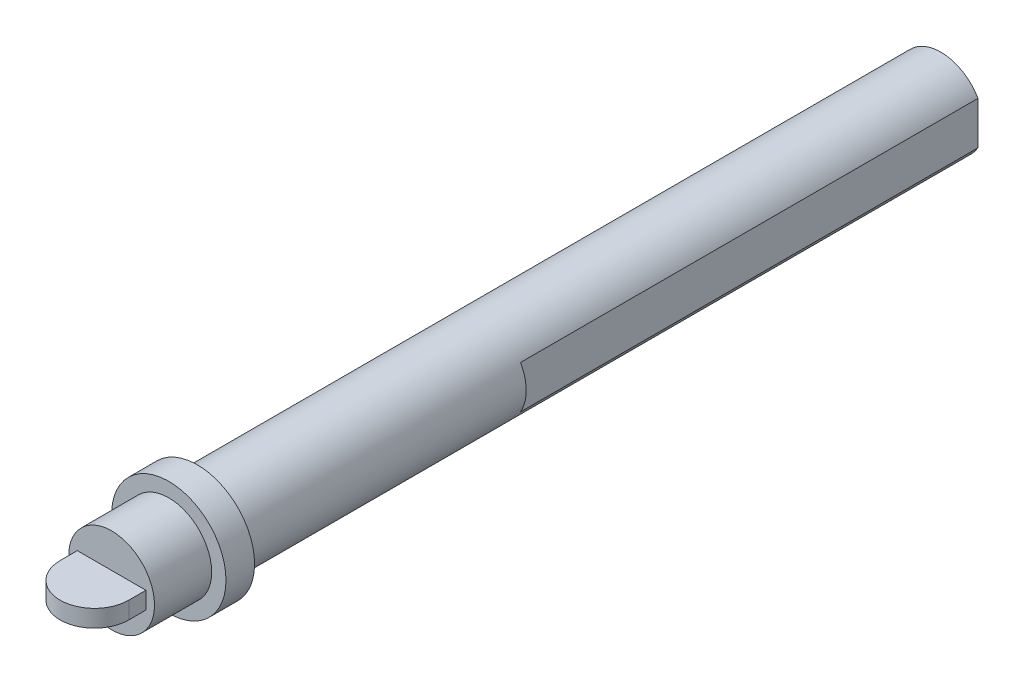
from build123d import *

# Parameters (mm, degrees)
SKETCH1_R           = 7.5
BOSS_EXTRUDE1_DEPTH = 130
SKETCH2_R           = 10
BOSS_EXTRUDE2_DEPTH = 5
BOSS_EXTRUDE3_START = 10
SKETCH3_R           = 7.5
BOSS_EXTRUDE3_DEPTH = 10
CUT_EXTRUDE1_START  = -80
CUT_EXTRUDE1_DEPTH  = 80
BOSS_EXTRUDE4_DEPTH = 1.5


with BuildPart() as part:
    # Sketch1 → Boss-Extrude1 (new body)
    with BuildSketch(Plane.XY):
        Circle(SKETCH1_R)
    extrude(amount=-BOSS_EXTRUDE1_DEPTH)

    # Sketch2 → Boss-Extrude2 (add)
    with BuildSketch(Plane.XY):
        Circle(SKETCH2_R)
    extrude(amount=BOSS_EXTRUDE2_DEPTH)

    # Sketch3 → Boss-Extrude3 (add)
    with BuildSketch(Plane.XY.offset(5).offset(BOSS_EXTRUDE3_START)):
        Circle(SKETCH3_R)
    extrude(amount=-BOSS_EXTRUDE3_DEPTH)

    # Sketch4 → Cut-Extrude1 (cut)
    with BuildSketch(Plane(origin=(0, 0, -130), x_dir=(-1, 0, 0), z_dir=(0, 0, -1)).offset(CUT_EXTRUDE1_START)):
        with BuildLine():
            Line((-6.5, 3.741657387), (-6.5, -3.741657387))
            ThreePointArc((-6.5, -3.741657387), (-7.5, 0), (-6.5, 3.741657387))
        make_face()
        with BuildLine():
            Line((6.5, 3.741657387), (6.5, -3.741657387))
            ThreePointArc((6.5, -3.741657387), (7.5, 0), (6.5, 3.741657387))
        make_face()
    extrude(amount=CUT_EXTRUDE1_DEPTH, mode=Mode.SUBTRACT)

    # Sketch6 → Boss-Extrude4 (add, symmetric)
    with BuildSketch(Plane(origin=(0, 0, 0), x_dir=(1, 0, 0), z_dir=(0, 1, 0))):
        with BuildLine():
            Line((-6, -18), (-6, -15))
            Line((-6, -15), (6, -15))
            Line((6, -15), (6, -18))
            ThreePointArc((6, -18), (0, -24), (-6, -18))
        make_face()
    extrude(amount=BOSS_EXTRUDE4_DEPTH, both=True)


solid = part.part
